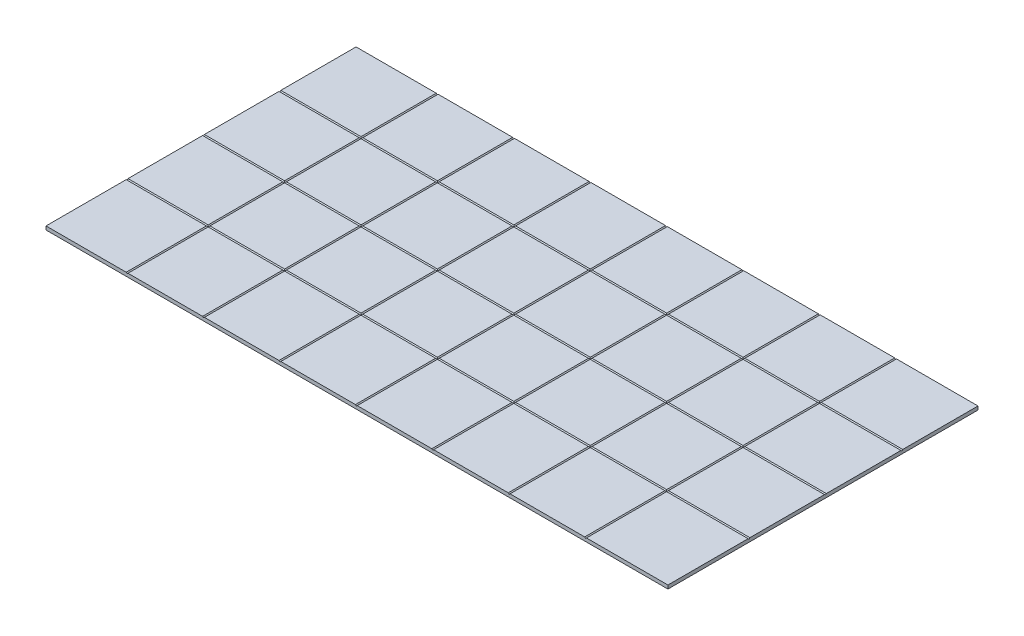
from build123d import *

# Parameters (mm, degrees)
SKETCH1_W           = 349
SKETCH1_H           = 174
BOSS_EXTRUDE1_DEPTH = 2
CUT_EXTRUDE1_DEPTH  = 245.326114036
LPATTERN1_COUNT     = 7
LPATTERN1_PITCH     = 42.88
CUT_EXTRUDE2_DEPTH  = 357.412177998
LPATTERN2_COUNT     = 3
LPATTERN2_PITCH     = 42.88


with BuildPart() as part:
    # Sketch1 → Boss-Extrude1 (new body)
    with BuildSketch(Plane(origin=(0, 0, 0), x_dir=(1, 0, 0), z_dir=(0, 1, 0))):
        Rectangle(SKETCH1_W, SKETCH1_H)
    extrude(amount=BOSS_EXTRUDE1_DEPTH)

    # Sketch3 → Cut-Extrude1 (cut, symmetric)
    with BuildSketch(Plane.XY.offset(84)):
        Polygon((-129.5, 2), (-128.5, 2), (-129, 1.5), align=None)
    cut_extrude1 = extrude(amount=CUT_EXTRUDE1_DEPTH, both=True, mode=Mode.SUBTRACT)

    # LPattern1: Cut-Extrude1 ×7
    with Locations(*[(i * LPATTERN1_PITCH, 0, 0) for i in range(1, LPATTERN1_COUNT)]):
        add(cut_extrude1, mode=Mode.SUBTRACT)

    # Sketch4 → Cut-Extrude2 (cut, symmetric)
    with BuildSketch(Plane(origin=(171.125, 0, 0), x_dir=(0, 0, -1), z_dir=(1, 0, 0))):
        Polygon((-41.5, 2), (-41, 2), (-41.5, 1.5), (-42, 2), align=None)
    cut_extrude2 = extrude(amount=CUT_EXTRUDE2_DEPTH, both=True, mode=Mode.SUBTRACT)

    # LPattern2: Cut-Extrude2 ×3
    with Locations(*[(0, 0, -i * LPATTERN2_PITCH) for i in range(1, LPATTERN2_COUNT)]):
        add(cut_extrude2, mode=Mode.SUBTRACT)


solid = part.part
